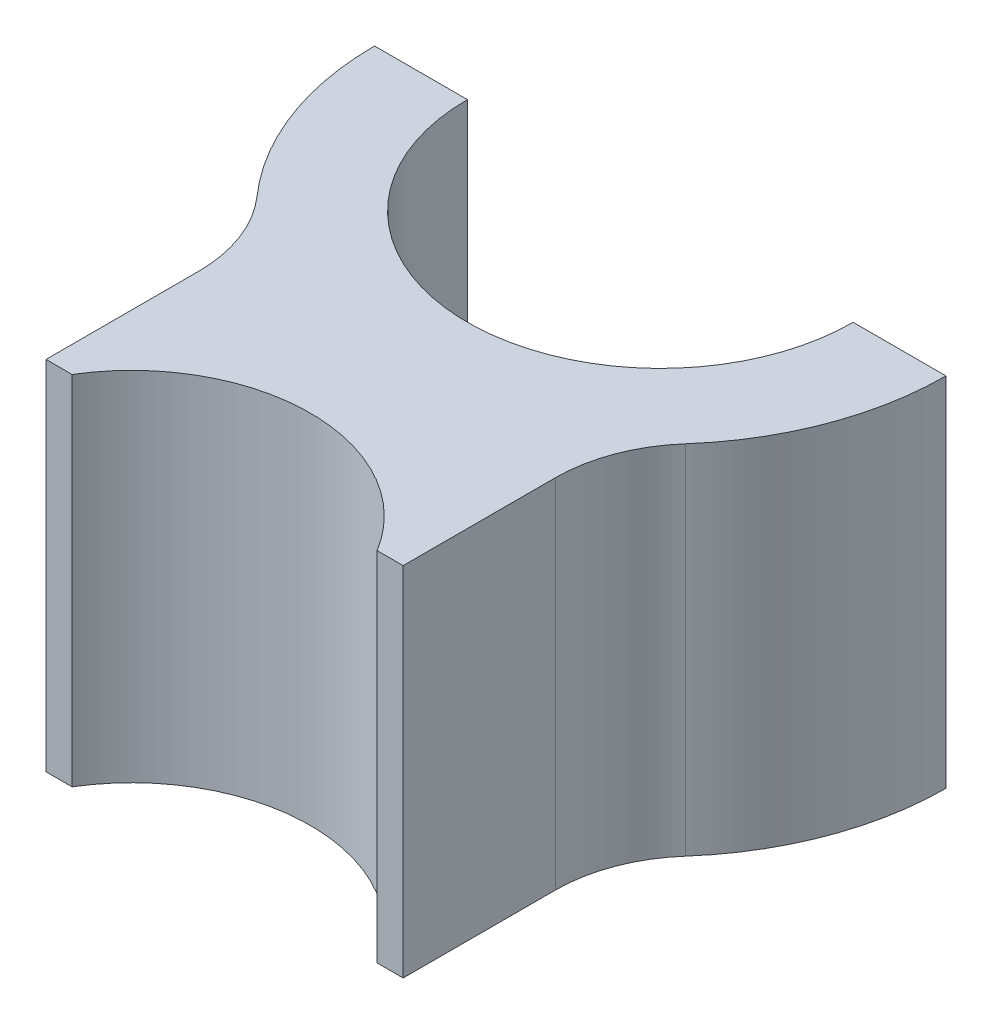
from build123d import *

# Parameters (mm, degrees)
EXTRUDE_1_DEPTH     = 25
SKETCH_2_W          = 28.626473145
SKETCH_2_H          = 10
CUT_EXTRUDE_1_DEPTH = 49.928519291


with BuildPart() as part:
    # Эскиз1 → Бобышка-Вытянуть1 (new body)
    with BuildSketch(Plane(origin=(0, 0, 0), x_dir=(1, 0, 0), z_dir=(0, 1, 0))):
        with BuildLine():
            Line((-12.5, -37), (-12.5, -19.843134833))
            ThreePointArc((-12.5, -19.843134833), (-13.145856533, -16.307600927), (-15, -13.228756555))
            ThreePointArc((-15, -13.228756555), (-18.708286934, -7.071067812), (-20, 0))
            Line((-20, 0), (-13.5, 0))
            ThreePointArc((-13.5, 0), (0, -13.5), (13.5, 0))
            Line((13.5, 0), (20, 0))
            ThreePointArc((20, 0), (18.708286934, -7.071067812), (15, -13.228756555))
            ThreePointArc((15, -13.228756555), (13.145856533, -16.307600927), (12.5, -19.843134833))
            Line((12.5, -19.843134833), (12.5, -37))
            ThreePointArc((12.5, -37), (0, -24.5), (-12.5, -37))
        make_face()
    extrude(amount=EXTRUDE_1_DEPTH)

    # Эскиз2 → Вырез-Вытянуть1 (cut, through all)
    with BuildSketch(Plane(origin=(0, 25, 0), x_dir=(1, 0, 0), z_dir=(0, 1, 0))):
        with Locations((0.56499618, -35.5)):
            Rectangle(SKETCH_2_W, SKETCH_2_H)
    extrude(amount=-CUT_EXTRUDE_1_DEPTH, mode=Mode.SUBTRACT)


solid = part.part
